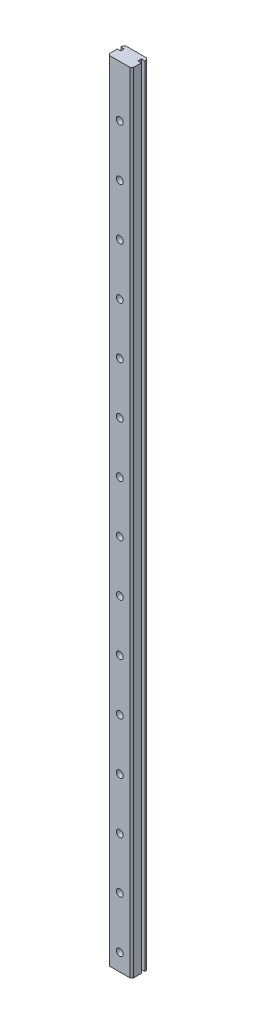
from build123d import *

# Parameters (mm, degrees)
EXTRUDE_1_DEPTH     = 230
SKETCH_2_R          = 1
CUT_EXTRUDE_1_DEPTH = 10
CHAMFER_1_SIZE      = 0.5
SKETCH_3_R          = 2.383304988
CUT_EXTRUDE_2_DEPTH = 1


with BuildPart() as part:
    # 草图1 → 凸台-拉伸1 (new body)
    with BuildSketch(Plane(origin=(0, 0, 0), x_dir=(1, 0, 0), z_dir=(0, 1, 0))):
        Polygon((-3.5, 0.4), (-3.5, -2.4), (3.5, -2.4), (3.5, 0.4), (2.5, 0.4), (2.5, 1.4), (3.5, 1.4), (3.5, 2.4), (-3.5, 2.4), (-3.5, 1.4), (-2.5, 1.4), (-2.5, 0.4), align=None)
    extrude(amount=EXTRUDE_1_DEPTH)

    # 草图2 → 切除-拉伸1 (cut)
    with BuildSketch(Plane(origin=(0, 0, -2.4), x_dir=(-1, 0, 0), z_dir=(0, 0, -1))):
        with Locations((0, 5)):
            Circle(SKETCH_2_R)
        with Locations((0, 20)):
            Circle(SKETCH_2_R)
        with Locations((0, 35)):
            Circle(SKETCH_2_R)
        with Locations((0, 50)):
            Circle(SKETCH_2_R)
        with Locations((0, 65)):
            Circle(SKETCH_2_R)
        with Locations((0, 80)):
            Circle(SKETCH_2_R)
        with Locations((0, 95)):
            Circle(SKETCH_2_R)
        with Locations((0, 110)):
            Circle(SKETCH_2_R)
        with Locations((0, 125)):
            Circle(SKETCH_2_R)
        with Locations((0, 140)):
            Circle(SKETCH_2_R)
        with Locations((0, 155)):
            Circle(SKETCH_2_R)
        with Locations((0, 170)):
            Circle(SKETCH_2_R)
        with Locations((0, 185)):
            Circle(SKETCH_2_R)
        with Locations((0, 200)):
            Circle(SKETCH_2_R)
        with Locations((0, 215)):
            Circle(SKETCH_2_R)
    extrude(amount=-CUT_EXTRUDE_1_DEPTH, mode=Mode.SUBTRACT)

    # 倒角1
    chamfer_1_edges = [part.edges().sort_by_distance(p)[0] for p in [
        (-3.5, 115, -2.4),
        (3.5, 115, -2.4),
        (3.5, 115, 2.4),
        (-3.5, 115, 2.4),
    ]]
    chamfer(chamfer_1_edges, length=CHAMFER_1_SIZE)

    # 草图3 → 切除-拉伸2 (cut)
    with BuildSketch(Plane(origin=(0, 0, -2.4), x_dir=(-1, 0, 0), z_dir=(0, 0, -1))):
        with Locations((0, 5)):
            Circle(SKETCH_3_R)
        with Locations((0, 20)):
            Circle(SKETCH_3_R)
        with Locations((0, 35)):
            Circle(SKETCH_3_R)
        with Locations((0, 50)):
            Circle(SKETCH_3_R)
        with Locations((0, 65)):
            Circle(SKETCH_3_R)
        with Locations((0, 80)):
            Circle(SKETCH_3_R)
        with Locations((0, 95)):
            Circle(SKETCH_3_R)
        with Locations((0, 110)):
            Circle(SKETCH_3_R)
        with Locations((0, 125)):
            Circle(SKETCH_3_R)
        with Locations((0, 140)):
            Circle(SKETCH_3_R)
        with Locations((0, 155)):
            Circle(SKETCH_3_R)
        with Locations((0, 170)):
            Circle(SKETCH_3_R)
        with Locations((0, 185)):
            Circle(SKETCH_3_R)
        with Locations((0, 200)):
            Circle(SKETCH_3_R)
        with Locations((0, 215)):
            Circle(SKETCH_3_R)
    extrude(amount=-CUT_EXTRUDE_2_DEPTH, mode=Mode.SUBTRACT)


solid = part.part
